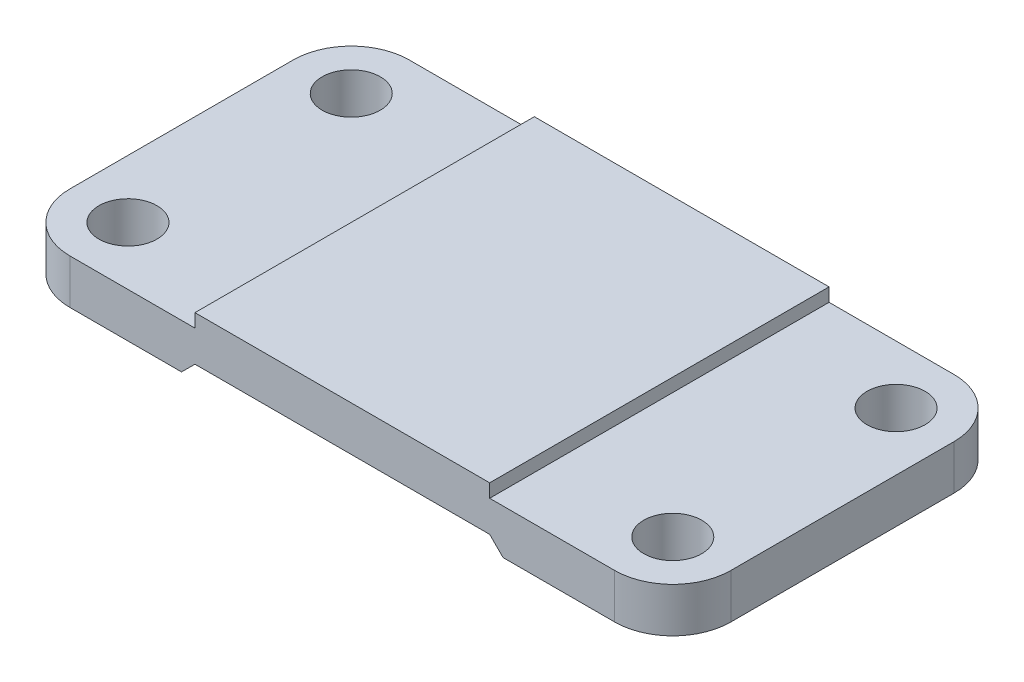
from build123d import *

# Parameters (mm, degrees)
SKETCH1_R           = 6.5
BOSS_EXTRUDE1_DEPTH = 10
CUT_EXTRUDE1_DEPTH  = 107.545764815
SKETCH3_W           = 66
SKETCH3_H           = 3
BOSS_EXTRUDE2_DEPTH = 76


with BuildPart() as part:
    # Sketch1 → Boss-Extrude1 (new body)
    with BuildSketch(Plane(origin=(0, 0, 0), x_dir=(1, 0, 0), z_dir=(0, 1, 0))):
        with BuildLine():
            Line((-61, 38), (61, 38))
            ThreePointArc((61, 38), (70.192388155, 34.192388155), (74, 25))
            Line((74, 25), (74, -25))
            ThreePointArc((74, -25), (70.192388155, -34.192388155), (61, -38))
            Line((61, -38), (-61, -38))
            ThreePointArc((-61, -38), (-70.192388155, -34.192388155), (-74, -25))
            Line((-74, -25), (-74, 25))
            ThreePointArc((-74, 25), (-70.192388155, 34.192388155), (-61, 38))
        make_face()
        with Locations(Location((-61, 25, 0), (0, 0, 270))):
            Circle(SKETCH1_R, mode=Mode.SUBTRACT)
        with Locations(Location((61, 25, 0), (0, 0, 90))):
            Circle(SKETCH1_R, mode=Mode.SUBTRACT)
        with Locations(Location((61, -25, 0), (0, 0, 270))):
            Circle(SKETCH1_R, mode=Mode.SUBTRACT)
        with Locations(Location((-61, -25, 0), (0, 0, 90))):
            Circle(SKETCH1_R, mode=Mode.SUBTRACT)
    extrude(amount=-BOSS_EXTRUDE1_DEPTH)

    # Sketch2 → Cut-Extrude1 (cut, through all)
    with BuildSketch(Plane.XY.offset(38)):
        Polygon((-36, -10), (36, -10), (33, -7), (-33, -7), align=None)
    extrude(amount=-CUT_EXTRUDE1_DEPTH, mode=Mode.SUBTRACT)

    # Sketch3 → Boss-Extrude2 (add, through all)
    with BuildSketch(Plane.XY.offset(38)):
        with Locations((0, 1.5)):
            Rectangle(SKETCH3_W, SKETCH3_H)
    extrude(amount=-BOSS_EXTRUDE2_DEPTH)


solid = part.part
